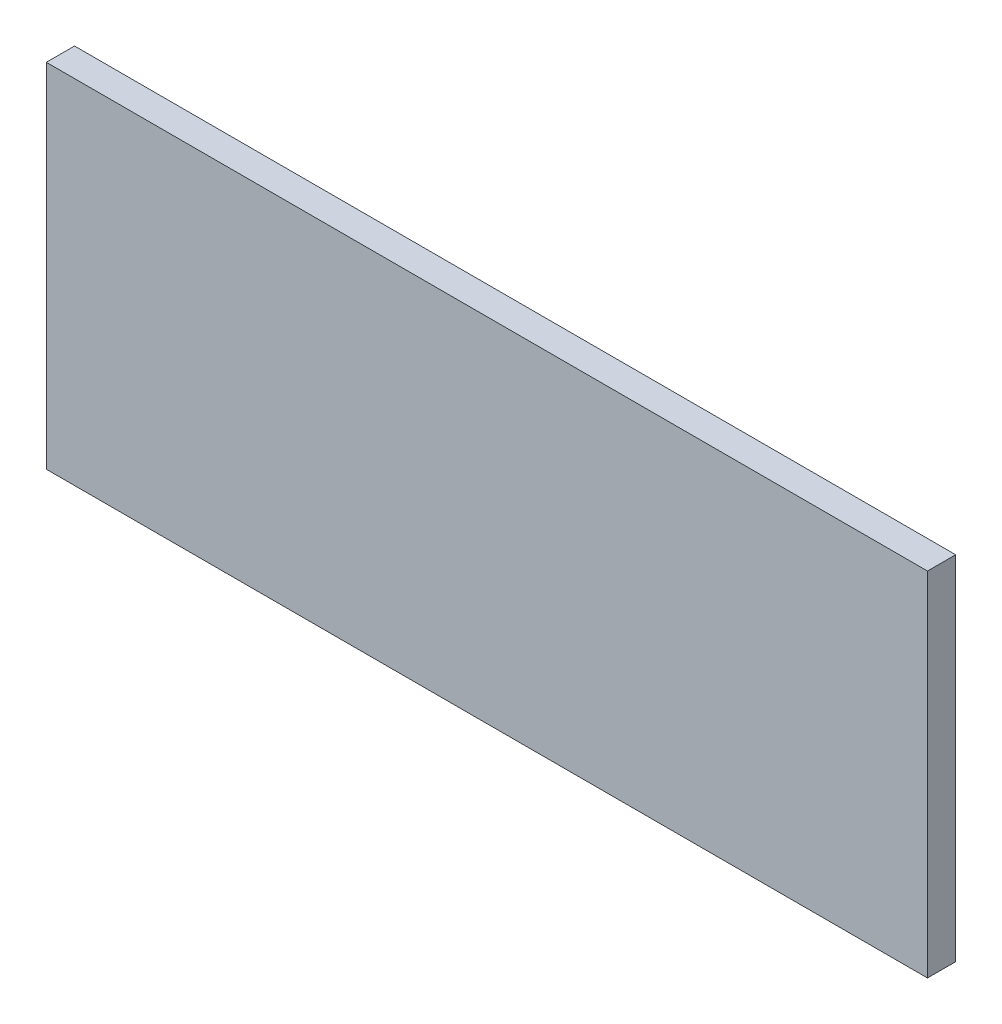
from build123d import *

# Parameters (mm, degrees)
SKETCH1_W           = 250
SKETCH1_H           = 100
BOSS_EXTRUDE1_DEPTH = 8


with BuildPart() as part:
    # Sketch1 → Boss-Extrude1 (new body)
    with BuildSketch(Plane.XY):
        with Locations((0, 50)):
            Rectangle(SKETCH1_W, SKETCH1_H)
    extrude(amount=BOSS_EXTRUDE1_DEPTH)


solid = part.part
